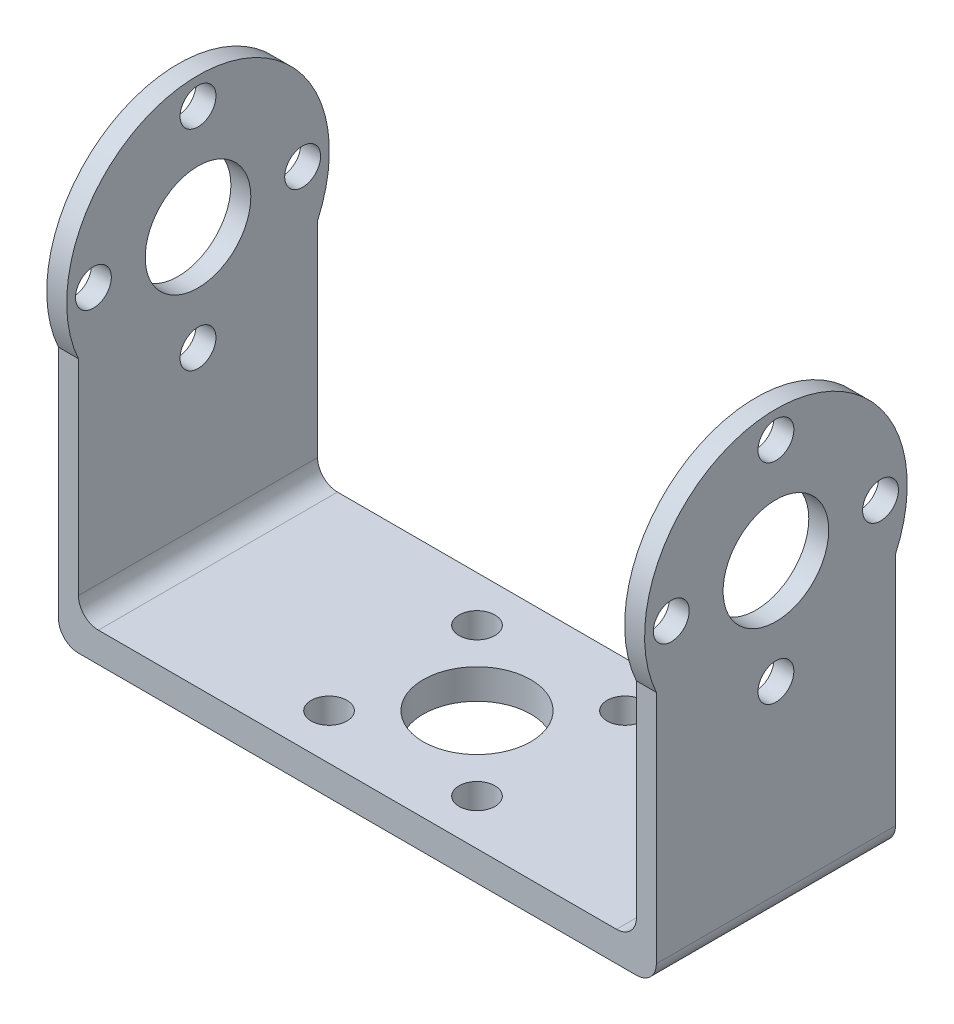
from build123d import *

# Parameters (mm, degrees)
CROQUIS1_W              = 60
CROQUIS1_H              = 24
SALIENTE_EXTRUIR1_DEPTH = 2
CROQUIS3_R              = 5.3
SALIENTE_EXTRUIR2_DEPTH = 2
CORTAR_EXTRUIR1_REACH   = 77.111
CROQUIS5_R              = 1.8
CROQUIS6_W              = 60
CROQUIS6_H              = 24
SALIENTE_EXTRUIR3_DEPTH = 1
CORTAR_EXTRUIR2_REACH   = 57.037
CROQUIS7_R              = 5.4
CROQUIS7_R_2            = 1.8
REDONDEO1_R             = 2


with BuildPart() as part:
    # Croquis1 → Saliente-Extruir1 (new body)
    with BuildSketch(Plane(origin=(0, 0, 0), x_dir=(1, 0, 0), z_dir=(0, 1, 0))):
        Rectangle(CROQUIS1_W, CROQUIS1_H)
    extrude(amount=SALIENTE_EXTRUIR1_DEPTH)

    # Croquis3 → Saliente-Extruir2 (add)
    with BuildSketch(Plane(origin=(30, 0, 0), x_dir=(0, 0, -1), z_dir=(1, 0, 0))):
        with BuildLine():
            Line((12, 2), (-12, 2))
            Line((-12, 2), (-12, 24.589091819))
            ThreePointArc((-12, 24.589091819), (0, 43.22), (12, 24.589091819))
            Line((12, 24.589091819), (12, 2))
        make_face()
        with Locations((0, 30.04)):
            Circle(CROQUIS3_R, mode=Mode.SUBTRACT)
    saliente_extruir2 = extrude(amount=-SALIENTE_EXTRUIR2_DEPTH)

    # Croquis5 → Cortar-Extruir1 (cut, up to next)
    with BuildSketch(Plane(origin=(30, 0, 0), x_dir=(0, 0, -1), z_dir=(1, 0, 0)), mode=Mode.PRIVATE) as cortar_extruir1_sk1:
        with Locations((0, 40.54)):
            Circle(CROQUIS5_R)
    cortar_extruir1_tool1 = extrude(cortar_extruir1_sk1.sketch, amount=-CORTAR_EXTRUIR1_REACH, mode=Mode.PRIVATE) & part.part
    # Croquis5 → Cortar-Extruir1 (cut, up to next)
    with BuildSketch(Plane(origin=(30, 0, 0), x_dir=(0, 0, -1), z_dir=(1, 0, 0)), mode=Mode.PRIVATE) as cortar_extruir1_sk2:
        with Locations((10.5, 30.04)):
            Circle(CROQUIS5_R)
    cortar_extruir1_tool2 = extrude(cortar_extruir1_sk2.sketch, amount=-CORTAR_EXTRUIR1_REACH, mode=Mode.PRIVATE) & part.part
    # Croquis5 → Cortar-Extruir1 (cut, up to next)
    with BuildSketch(Plane(origin=(30, 0, 0), x_dir=(0, 0, -1), z_dir=(1, 0, 0)), mode=Mode.PRIVATE) as cortar_extruir1_sk3:
        with Locations((0, 19.54)):
            Circle(CROQUIS5_R)
    cortar_extruir1_tool3 = extrude(cortar_extruir1_sk3.sketch, amount=-CORTAR_EXTRUIR1_REACH, mode=Mode.PRIVATE) & part.part
    # Croquis5 → Cortar-Extruir1 (cut, up to next)
    with BuildSketch(Plane(origin=(30, 0, 0), x_dir=(0, 0, -1), z_dir=(1, 0, 0)), mode=Mode.PRIVATE) as cortar_extruir1_sk4:
        with Locations((-10.5, 30.04)):
            Circle(CROQUIS5_R)
    cortar_extruir1_tool4 = extrude(cortar_extruir1_sk4.sketch, amount=-CORTAR_EXTRUIR1_REACH, mode=Mode.PRIVATE) & part.part
    cortar_extruir1_1 = cortar_extruir1_tool1.solids().sort_by_distance((30, 40.54, 0))[0]
    add(cortar_extruir1_1, mode=Mode.SUBTRACT)
    cortar_extruir1_2 = cortar_extruir1_tool2.solids().sort_by_distance((30, 30.04, -10.5))[0]
    add(cortar_extruir1_2, mode=Mode.SUBTRACT)
    cortar_extruir1_3 = cortar_extruir1_tool3.solids().sort_by_distance((30, 19.54, 0))[0]
    add(cortar_extruir1_3, mode=Mode.SUBTRACT)
    cortar_extruir1_4 = cortar_extruir1_tool4.solids().sort_by_distance((30, 30.04, 10.5))[0]
    add(cortar_extruir1_4, mode=Mode.SUBTRACT)
    cortar_extruir1 = cortar_extruir1_1 + cortar_extruir1_2 + cortar_extruir1_3 + cortar_extruir1_4  # Cortar-Extruir1 as one shape, for the pattern or mirror that repeats it

    # Simetría1: Saliente-Extruir2, Cortar-Extruir1 across plane
    add(saliente_extruir2.mirror(Plane(origin=(0, 0, 0), x_dir=(0, 0, 1), z_dir=(1, 0, 0))))
    add(cortar_extruir1.mirror(Plane(origin=(0, 0, 0), x_dir=(0, 0, 1), z_dir=(1, 0, 0))), mode=Mode.SUBTRACT)

    # Croquis6 → Saliente-Extruir3 (add)
    with BuildSketch(Plane.XZ):
        Rectangle(CROQUIS6_W, CROQUIS6_H)
    extrude(amount=SALIENTE_EXTRUIR3_DEPTH)

    # Croquis7 → Cortar-Extruir2 (cut, up to next)
    with BuildSketch(Plane.XZ.offset(1), mode=Mode.PRIVATE) as cortar_extruir2_sk1:
        with Locations(Location((0, 0, 0), (0, 0, 270))):
            Circle(CROQUIS7_R)
    cortar_extruir2_tool1 = extrude(cortar_extruir2_sk1.sketch, amount=-CORTAR_EXTRUIR2_REACH, mode=Mode.PRIVATE) & part.part
    # Croquis7 → Cortar-Extruir2 (cut, up to next)
    with BuildSketch(Plane.XZ.offset(1), mode=Mode.PRIVATE) as cortar_extruir2_sk2:
        with Locations(Location((7.424621202, -7.424621202, 0), (0, 0, 270))):
            Circle(CROQUIS7_R_2)
    cortar_extruir2_tool2 = extrude(cortar_extruir2_sk2.sketch, amount=-CORTAR_EXTRUIR2_REACH, mode=Mode.PRIVATE) & part.part
    # Croquis7 → Cortar-Extruir2 (cut, up to next)
    with BuildSketch(Plane.XZ.offset(1), mode=Mode.PRIVATE) as cortar_extruir2_sk3:
        with Locations(Location((-7.423621202, -7.423621202, 0), (0, 0, 270))):
            Circle(CROQUIS7_R_2)
    cortar_extruir2_tool3 = extrude(cortar_extruir2_sk3.sketch, amount=-CORTAR_EXTRUIR2_REACH, mode=Mode.PRIVATE) & part.part
    # Croquis7 → Cortar-Extruir2 (cut, up to next)
    with BuildSketch(Plane.XZ.offset(1), mode=Mode.PRIVATE) as cortar_extruir2_sk4:
        with Locations(Location((-7.422621202, 7.424621202, 0), (0, 0, 270))):
            Circle(CROQUIS7_R_2)
    cortar_extruir2_tool4 = extrude(cortar_extruir2_sk4.sketch, amount=-CORTAR_EXTRUIR2_REACH, mode=Mode.PRIVATE) & part.part
    # Croquis7 → Cortar-Extruir2 (cut, up to next)
    with BuildSketch(Plane.XZ.offset(1), mode=Mode.PRIVATE) as cortar_extruir2_sk5:
        with Locations(Location((7.425621202, 7.423621202, 0), (0, 0, 270))):
            Circle(CROQUIS7_R_2)
    cortar_extruir2_tool5 = extrude(cortar_extruir2_sk5.sketch, amount=-CORTAR_EXTRUIR2_REACH, mode=Mode.PRIVATE) & part.part
    add(cortar_extruir2_tool1.solids().sort_by_distance((0, -1, 0))[0], mode=Mode.SUBTRACT)
    add(cortar_extruir2_tool2.solids().sort_by_distance((7.424621, -1, -7.424621))[0], mode=Mode.SUBTRACT)
    add(cortar_extruir2_tool3.solids().sort_by_distance((-7.423621, -1, -7.423621))[0], mode=Mode.SUBTRACT)
    add(cortar_extruir2_tool4.solids().sort_by_distance((-7.422621, -1, 7.424621))[0], mode=Mode.SUBTRACT)
    add(cortar_extruir2_tool5.solids().sort_by_distance((7.425621, -1, 7.423621))[0], mode=Mode.SUBTRACT)

    # Redondeo1
    redondeo1_edges = [part.edges().sort_by_distance(p)[0] for p in [
        (-28, 2, 0),
        (28, 2, 0),
        (-30, -1, 0),
        (30, -1, 0),
    ]]
    fillet(redondeo1_edges, radius=REDONDEO1_R)


solid = part.part
